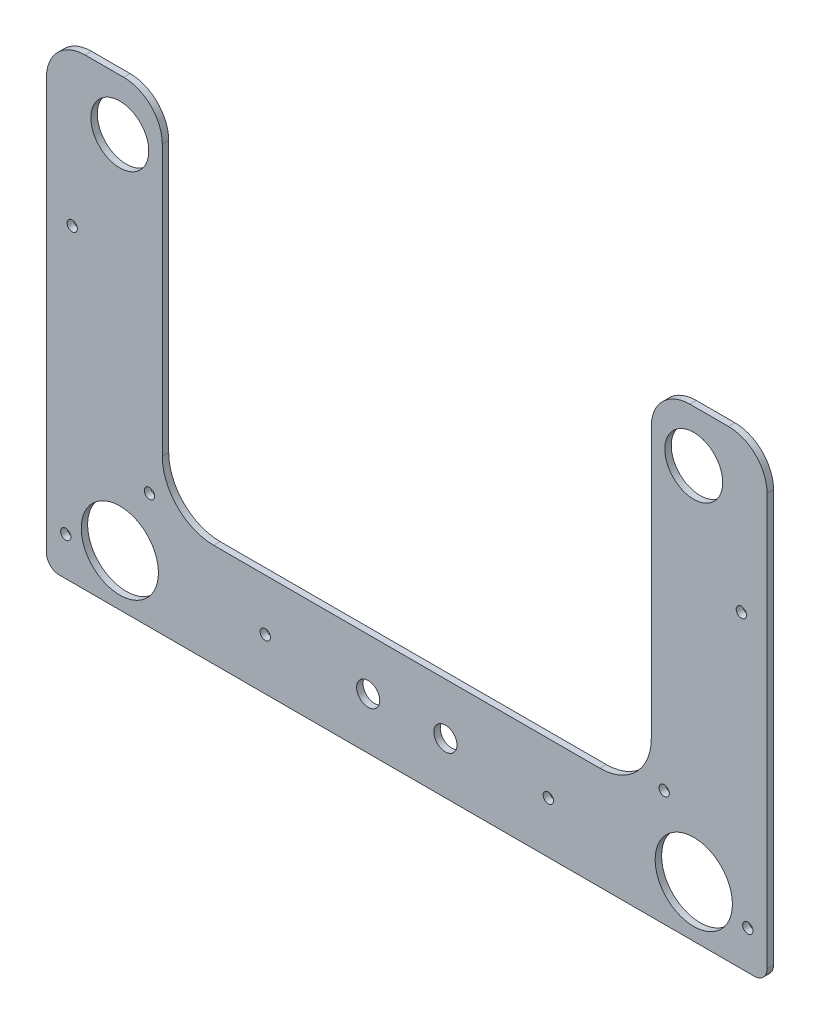
from build123d import *

# Parameters (mm, degrees)
SKETCH1_R           = 14.2875
SKETCH1_R_2         = 19.05
SKETCH1_R_3         = 2.54
SKETCH1_R_4         = 5.715
BOSS_EXTRUDE3_DEPTH = 3.175
SKETCH2_W           = 355.6
SKETCH2_H           = 19.05
CUT_EXTRUDE1_DEPTH  = 290.621961572
FILLET1_R           = 19.05


with BuildPart() as part:
    # Sketch1 → Boss-Extrude3 (new body)
    with BuildSketch(Plane.XY):
        with BuildLine():
            Line((120.65, -152.4), (120.65, -6.35))
            Line((120.65, -6.35), (120.65, 6.35))
            ThreePointArc((120.65, 6.35), (124.369743879, 15.330256121), (133.35, 19.05))
            Line((133.35, 19.05), (165.1, 19.05))
            ThreePointArc((165.1, 19.05), (174.080256121, 15.330256121), (177.8, 6.35))
            Line((177.8, 6.35), (177.8, -6.35))
            Line((177.8, -6.35), (177.8, -222.25))
            ThreePointArc((177.8, -222.25), (175.940128061, -226.740128061), (171.45, -228.6))
            Line((171.45, -228.6), (12.7, -228.6))
            Line((12.7, -228.6), (-12.7, -228.6))
            Line((-12.7, -228.6), (-171.45, -228.6))
            ThreePointArc((-171.45, -228.6), (-175.940128061, -226.740128061), (-177.8, -222.25))
            Line((-177.8, -222.25), (-177.8, -6.35))
            Line((-177.8, -6.35), (-177.8, 6.35))
            ThreePointArc((-177.8, 6.35), (-174.080256121, 15.330256121), (-165.1, 19.05))
            Line((-165.1, 19.05), (-133.35, 19.05))
            ThreePointArc((-133.35, 19.05), (-124.369743879, 15.330256121), (-120.65, 6.35))
            Line((-120.65, 6.35), (-120.65, -6.35))
            Line((-120.65, -6.35), (-120.65, -152.4))
            ThreePointArc((-120.65, -152.4), (-113.210512242, -170.360512242), (-95.25, -177.8))
            Line((-95.25, -177.8), (-12.7, -177.8))
            Line((-12.7, -177.8), (12.7, -177.8))
            Line((12.7, -177.8), (95.25, -177.8))
            ThreePointArc((95.25, -177.8), (113.210512242, -170.360512242), (120.65, -152.4))
        make_face()
        with Locations((141.605, -25.4)):
            Circle(SKETCH1_R, mode=Mode.SUBTRACT)
        with Locations(Location((-141.605, -25.4, 0), (0, 0, 180))):
            Circle(SKETCH1_R, mode=Mode.SUBTRACT)
        with Locations((-141.605, -203.2)):
            Circle(SKETCH1_R_2, mode=Mode.SUBTRACT)
        with Locations(Location((141.605, -203.2, 0), (0, 0, 180))):
            Circle(SKETCH1_R_2, mode=Mode.SUBTRACT)
        with Locations((-69.85, -203.2)):
            Circle(SKETCH1_R_3, mode=Mode.SUBTRACT)
        with Locations(Location((69.85, -203.2, 0), (0, 0, 180))):
            Circle(SKETCH1_R_3, mode=Mode.SUBTRACT)
        with Locations((-19.05, -203.2)):
            Circle(SKETCH1_R_4, mode=Mode.SUBTRACT)
        with Locations((-149.225, 6.35)):
            Circle(SKETCH1_R_3, mode=Mode.SUBTRACT)
        with Locations(Location((149.225, 6.35, 0), (0, 0, 180))):
            Circle(SKETCH1_R_3, mode=Mode.SUBTRACT)
        with Locations((-168.275, -209.55)):
            Circle(SKETCH1_R_3, mode=Mode.SUBTRACT)
        with Locations(Location((168.275, -209.55, 0), (0, 0, 180))):
            Circle(SKETCH1_R_3, mode=Mode.SUBTRACT)
        with Locations((-165.1, -76.2)):
            Circle(SKETCH1_R_3, mode=Mode.SUBTRACT)
        with Locations(Location((165.1, -76.2, 0), (0, 0, 180))):
            Circle(SKETCH1_R_3, mode=Mode.SUBTRACT)
        with Locations((-127, -171.45)):
            Circle(SKETCH1_R_3, mode=Mode.SUBTRACT)
        with Locations(Location((127, -171.45, 0), (0, 0, 180))):
            Circle(SKETCH1_R_3, mode=Mode.SUBTRACT)
        with Locations(Location((19.05, -203.2, 0), (0, 0, 180))):
            Circle(SKETCH1_R_4, mode=Mode.SUBTRACT)
    extrude(amount=BOSS_EXTRUDE3_DEPTH)

    # Sketch2 → Cut-Extrude1 (cut, through all)
    with BuildSketch(Plane.XY.offset(3.175)):
        with Locations((0, 9.525)):
            Rectangle(SKETCH2_W, SKETCH2_H)
    extrude(amount=-CUT_EXTRUDE1_DEPTH, mode=Mode.SUBTRACT)

    # Fillet1
    fillet1_edges = [part.edges().sort_by_distance(p)[0] for p in [
        (-177.8, 0, 1.5875),
        (120.65, 0, 1.5875),
        (177.8, 0, 1.5875),
        (-120.65, 0, 1.5875),
    ]]
    fillet(fillet1_edges, radius=FILLET1_R)


solid = part.part
